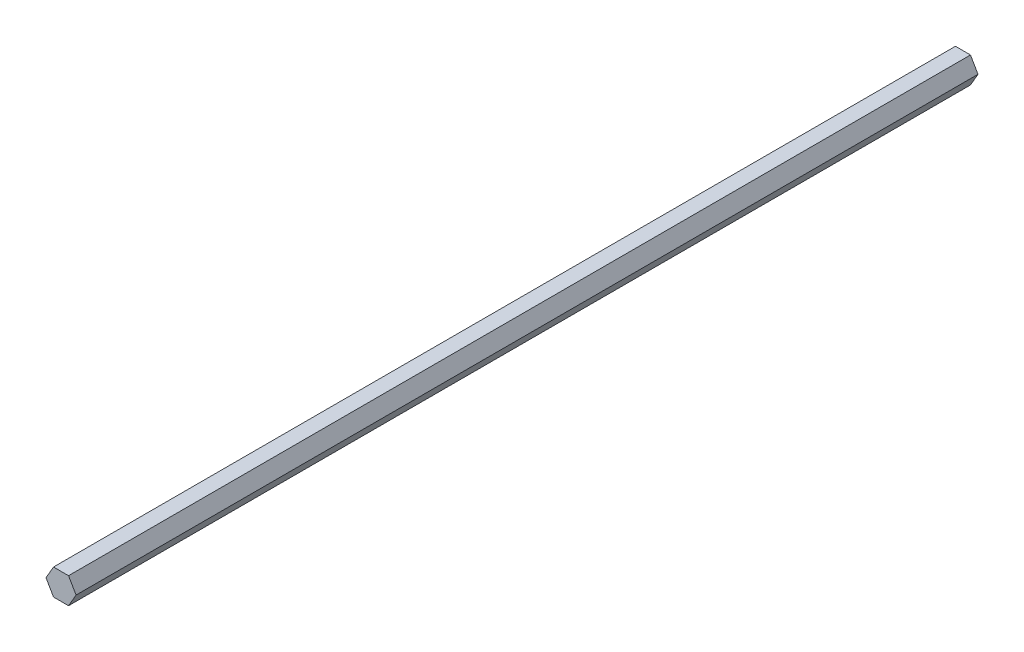
from build123d import *

# Parameters (mm, degrees)
BOSS_EXTRUDE1_DEPTH = 220


with BuildPart() as part:
    # Sketch1 → Boss-Extrude1 (new body)
    with BuildSketch(Plane.XY):
        Polygon((-3.666174209, 0), (-1.833087105, -3.175), (1.833087105, -3.175), (3.666174209, 0), (1.833087105, 3.175), (-1.833087105, 3.175), align=None)
    extrude(amount=BOSS_EXTRUDE1_DEPTH)


solid = part.part
